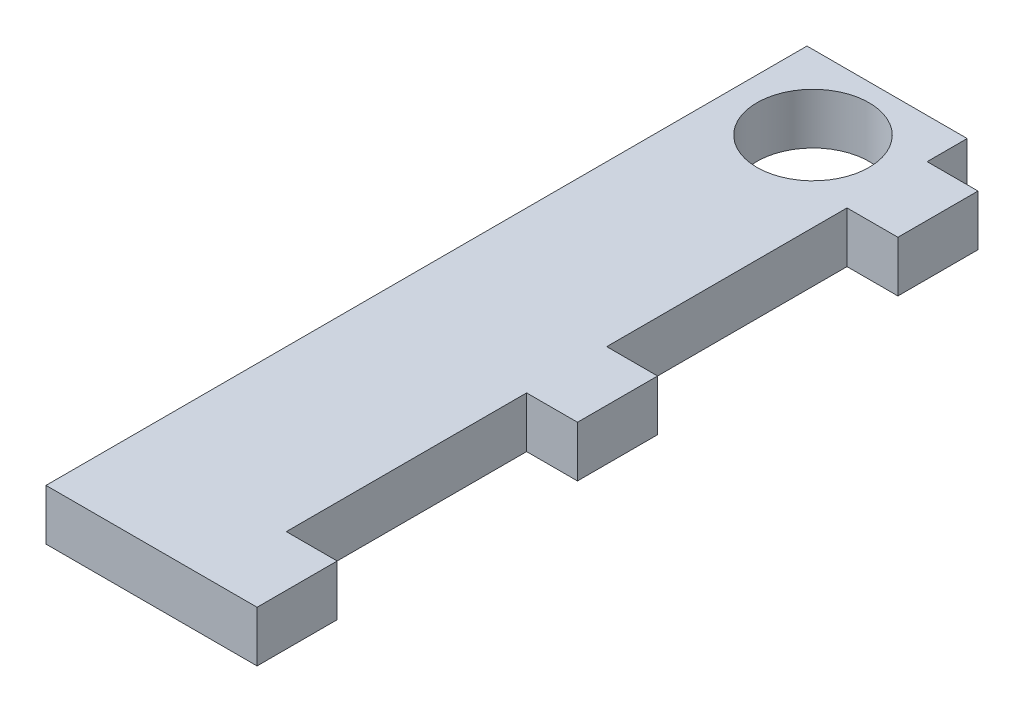
from build123d import *

# Parameters (mm, degrees)
SKETCH1_R           = 7
BOSS_EXTRUDE1_DEPTH = 3.175


with BuildPart() as part:
    # Sketch1 → Boss-Extrude1 (new, symmetric)
    with BuildSketch(Plane(origin=(0, 0, 0), x_dir=(1, 0, 0), z_dir=(0, 1, 0))):
        Polygon((-13.175, 47.5), (-13.175, -47.5), (13.175, -47.5), (13.175, -37.5), (6.825, -37.5), (6.825, -7.5), (13.175, -7.5), (13.175, 2.5), (6.825, 2.5), (6.825, 32.5), (13.175, 32.5), (13.175, 42.5), (6.825, 42.5), (6.825, 47.5), align=None)
        with Locations(Location((-3.175, 38.25, 0), (0, 0, 270))):
            Circle(SKETCH1_R, mode=Mode.SUBTRACT)
    extrude(amount=BOSS_EXTRUDE1_DEPTH, both=True)


solid = part.part
